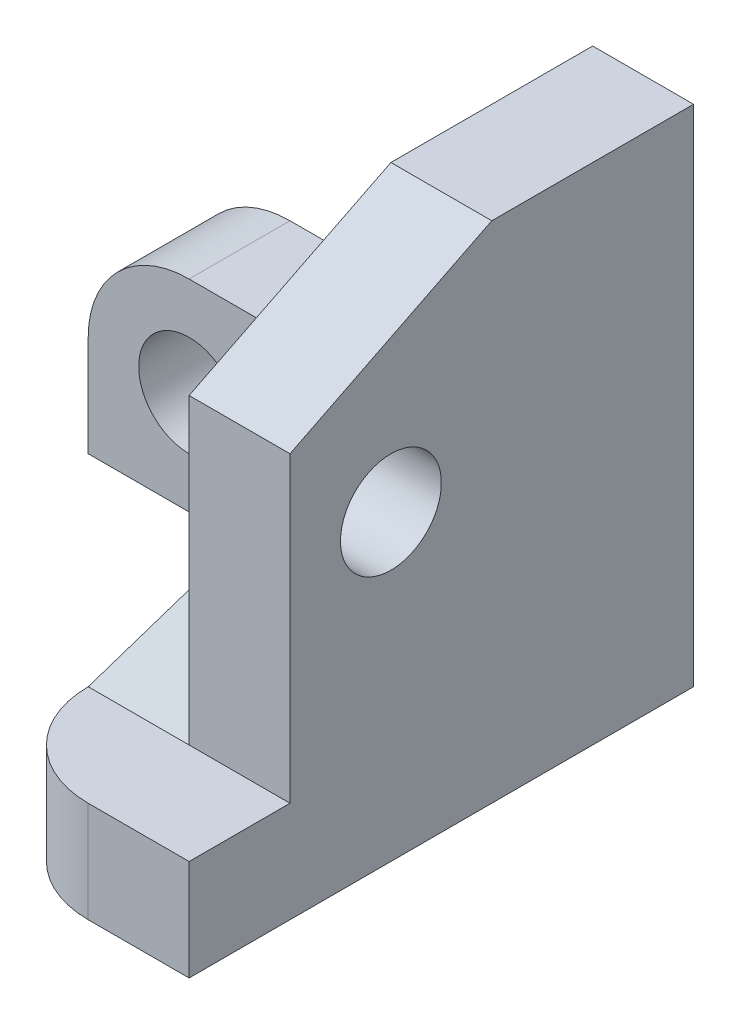
from build123d import *

# Parameters (mm, degrees)
SZKIC1_R                    = 5
DODANIE_WYCI_GNI_CIE3_DEPTH = 10
DODANIE_WYCI_GNI_CIE4_DEPTH = 50
WYTNIJ_WYCI_GNI_CIE1_DEPTH  = 40
SZKIC5_R                    = 5
WYTNIJ_WYCI_GNI_CIE2_DEPTH  = 40
DODANIE_WYCI_GNI_CIE5_DEPTH = 10
DODANIE_WYCI_GNI_CIE6_DEPTH = 10


with BuildPart() as part:
    # Szkic1 → Dodanie-wyciągnięcie3 (new body)
    with BuildSketch(Plane.XY):
        with BuildLine():
            Line((0, 0), (40, 0))
            Line((40, 0), (40, 20))
            Line((40, 20), (10, 20))
            ThreePointArc((10, 20), (2.928932188, 17.071067812), (0, 10))
            Line((0, 10), (0, 0))
        make_face()
        with Locations((10, 10)):
            Circle(SZKIC1_R, mode=Mode.SUBTRACT)
    extrude(amount=DODANIE_WYCI_GNI_CIE3_DEPTH)

    # Szkic2 → Dodanie-wyciągnięcie4 (add)
    with BuildSketch(Plane(origin=(0, 0, 0), x_dir=(1, 0, 0), z_dir=(0, 1, 0))):
        Polygon((40, 0), (40, -10), (40, -40), (50, -40), (50, 0), align=None)
    extrude(amount=DODANIE_WYCI_GNI_CIE4_DEPTH)

    # Szkic3 → Wytnij-wyciągnięcie1 (cut)
    with BuildSketch(Plane.ZY.offset(-40)):
        Polygon((40, 40), (20, 50), (40, 50), align=None)
    extrude(amount=-WYTNIJ_WYCI_GNI_CIE1_DEPTH, mode=Mode.SUBTRACT)

    # Szkic5 → Wytnij-wyciągnięcie2 (cut)
    with BuildSketch(Plane.ZY.offset(-40)):
        with Locations((30, 30)):
            Circle(SZKIC5_R)
    extrude(amount=-WYTNIJ_WYCI_GNI_CIE2_DEPTH, mode=Mode.SUBTRACT)

    # Szkic6 → Dodanie-wyciągnięcie5 (add)
    with BuildSketch(Plane.ZY.offset(-40)):
        Polygon((10, 0), (10, 20), (40, 10), (40, 0), align=None)
    extrude(amount=DODANIE_WYCI_GNI_CIE5_DEPTH)

    # Szkic7 → Dodanie-wyciągnięcie6 (add)
    with BuildSketch(Plane(origin=(0, 0, 0), x_dir=(1, 0, 0), z_dir=(0, 1, 0))):
        with BuildLine():
            Line((50, -40), (30, -40))
            ThreePointArc((30, -40), (32.928932188, -47.071067812), (40, -50))
            Line((40, -50), (50, -50))
            Line((50, -50), (50, -40))
        make_face()
    extrude(amount=DODANIE_WYCI_GNI_CIE6_DEPTH)


solid = part.part
